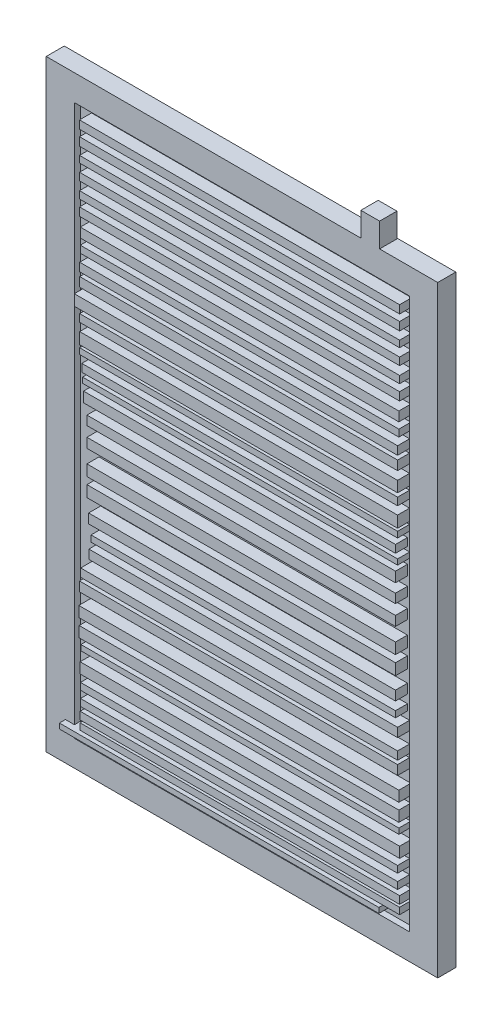
from build123d import *

# Parameters (mm, degrees)
SKETCH1_W           = 65
SKETCH1_H           = 100
BOSS_EXTRUDE1_DEPTH = 3
SKETCH2_W           = 55.410167814
SKETCH2_H           = 90.98098151
CUT_EXTRUDE1_DEPTH  = 1
SKETCH3_W           = 55.623558632
SKETCH3_H           = 91.416954534
CUT_EXTRUDE2_DEPTH  = 1
SKETCH6_W           = 3.108064818
SKETCH6_H           = 2.87479715
BOSS_EXTRUDE3_DEPTH = 4
SKETCH7_W           = 53.138202779
SKETCH7_H           = 1.34003587
SKETCH7_H_2         = 1.367002675
SKETCH7_H_3         = 1.093138183
SKETCH7_H_4         = 1.2410645
SKETCH7_H_5         = 1.197960463
SKETCH7_H_6         = 1.349260721
SKETCH7_W_2         = 52.888399092
SKETCH7_H_7         = 1.564219447
SKETCH7_H_8         = 1.154957354
SKETCH7_W_3         = 52.771419101
SKETCH7_H_9         = 1.382110168
SKETCH7_H_10        = 1.528385576
SKETCH7_W_4         = 53.663634192
SKETCH7_H_11        = 1.80040931
SKETCH7_H_12        = 1.2486786
SKETCH7_H_13        = 1.893914185
SKETCH7_H_14        = 0.973420041
SKETCH7_W_5         = 52.073122621
SKETCH7_H_15        = 1.279744006
SKETCH7_W_6         = 52.292340795
SKETCH7_H_16        = 0.896495241
SKETCH7_W_7         = 51.78751772
SKETCH7_H_17        = 1.679645233
SKETCH7_W_8         = 51.221344093
SKETCH7_H_18        = 1.510054375
SKETCH7_H_19        = 1.595977351
SKETCH7_H_20        = 1.821474854
SKETCH7_H_21        = 1.874986332
SKETCH7_W_9         = 50.944197518
SKETCH7_H_22        = 1.571177337
SKETCH7_W_10        = 50.546929275
SKETCH7_H_23        = 1.032965843
SKETCH7_W_11        = 51.245225755
SKETCH7_H_24        = 1.49164225
SKETCH7_W_12        = 52.610512912
SKETCH7_H_25        = 1.346344249
SKETCH7_W_13        = 52.805112466
SKETCH7_H_26        = 1.56611489
SKETCH7_W_14        = 53.13344098
SKETCH7_H_27        = 1.744841701
SKETCH7_W_15        = 53.070823892
SKETCH7_H_28        = 1.769376556
SKETCH7_W_16        = 52.783863166
SKETCH7_H_29        = 0.909486208
SKETCH7_W_17        = 53.033666853
SKETCH7_H_30        = 1.760540006
SKETCH7_W_18        = 52.646955084
SKETCH7_H_31        = 1.124717702
SKETCH7_H_32        = 1.14667208
SKETCH7_H_33        = 1.255688916
SKETCH7_H_34        = 1.074967726
SKETCH7_H_35        = 0.859854663
BOSS_EXTRUDE4_DEPTH = 2


with BuildPart() as part:
    # Sketch1 → Boss-Extrude1 (new body)
    with BuildSketch(Plane.XY):
        Rectangle(SKETCH1_W, SKETCH1_H)
    extrude(amount=BOSS_EXTRUDE1_DEPTH)

    # Sketch2 → Cut-Extrude1 (cut)
    with BuildSketch(Plane(origin=(0, 0, 0), x_dir=(-1, 0, 0), z_dir=(0, 0, -1))):
        Rectangle(SKETCH2_W, SKETCH2_H)
    extrude(amount=-CUT_EXTRUDE1_DEPTH, mode=Mode.SUBTRACT)

    # Sketch3 → Cut-Extrude2 (cut)
    with BuildSketch(Plane.XY.offset(3)):
        Rectangle(SKETCH3_W, SKETCH3_H)
    extrude(amount=-CUT_EXTRUDE2_DEPTH, mode=Mode.SUBTRACT)

    # Sketch6 → Boss-Extrude3 (add)
    with BuildSketch(Plane(origin=(0, 50, 0), x_dir=(1, 0, 0), z_dir=(0, 1, 0))):
        with Locations((21.296574144, -1.562601425)):
            Rectangle(SKETCH6_W, SKETCH6_H)
    extrude(amount=BOSS_EXTRUDE3_DEPTH)

    # Sketch7 → Boss-Extrude4 (add)
    with BuildSketch(Plane.XY.offset(2)):
        with Locations((0.599551955, 43.969609562)):
            Rectangle(SKETCH7_W, SKETCH7_H)
        with Locations((0.599551955, 41.538839141)):
            Rectangle(SKETCH7_W, SKETCH7_H_2)
        with Locations((0.599551955, 38.992532951)):
            Rectangle(SKETCH7_W, SKETCH7_H_3)
        with Locations((0.599551955, 36.493140866)):
            Rectangle(SKETCH7_W, SKETCH7_H_4)
        with Locations((0.599551955, 33.867810607)):
            Rectangle(SKETCH7_W, SKETCH7_H_5)
        with Locations((0.599551955, 31.458436664)):
            Rectangle(SKETCH7_W, SKETCH7_H_6)
        with Locations((0.599551954, 28.510640838)):
            Rectangle(SKETCH7_W_2, SKETCH7_H_7)
        with Locations((0.599551954, 26.112437241)):
            Rectangle(SKETCH7_W_2, SKETCH7_H_8)
        with Locations((0.446107546, 23.502504221)):
            Rectangle(SKETCH7_W_3, SKETCH7_H_9)
        with Locations((0.446107546, 21.366739211)):
            Rectangle(SKETCH7_W_3, SKETCH7_H_10)
        with Locations((0, 18.320450523)):
            Rectangle(SKETCH7_W_4, SKETCH7_H_11)
        with Locations((0.446107546, 16.176862315)):
            Rectangle(SKETCH7_W_3, SKETCH7_H_12)
        with Locations((0.446107546, 13.275450546)):
            Rectangle(SKETCH7_W_3, SKETCH7_H_13)
        with Locations((0.446107546, 11.407120898)):
            Rectangle(SKETCH7_W_3, SKETCH7_H_14)
        with Locations((0.446107545, 9.187182904)):
            Rectangle(SKETCH7_W_5, SKETCH7_H_15)
        with Locations((0.685646698, 7.470402799)):
            Rectangle(SKETCH7_W_6, SKETCH7_H_16)
        with Locations((0.588909996, 5.14333033)):
            Rectangle(SKETCH7_W_7, SKETCH7_H_17)
        with Locations((0.871996809, 2.062189427)):
            Rectangle(SKETCH7_W_8, SKETCH7_H_18)
        with Locations((0.871996809, -1.172018535)):
            Rectangle(SKETCH7_W_8, SKETCH7_H_19)
        with Locations((0.871996809, -5.111412921)):
            Rectangle(SKETCH7_W_8, SKETCH7_H_20)
        with Locations((0.871996809, -8.118690186)):
            Rectangle(SKETCH7_W_8, SKETCH7_H_21)
        with Locations((1.010570097, -11.904269807)):
            Rectangle(SKETCH7_W_9, SKETCH7_H_22)
        with Locations((1.209204219, -14.593957629)):
            Rectangle(SKETCH7_W_10, SKETCH7_H_23)
        with Locations((1.209204219, -17.029411585)):
            Rectangle(SKETCH7_W_11, SKETCH7_H_24)
        with Locations((0.52656064, -20.359590561)):
            Rectangle(SKETCH7_W_12, SKETCH7_H_25)
        with Locations((0.429260863, -22.436236668)):
            Rectangle(SKETCH7_W_13, SKETCH7_H_26)
        with Locations((0.47703101, -26.096936567)):
            Rectangle(SKETCH7_W_14, SKETCH7_H_27)
        with Locations((0.508339554, -28.969283574)):
            Rectangle(SKETCH7_W_15, SKETCH7_H_28)
        with Locations((0.651819917, -31.122255567)):
            Rectangle(SKETCH7_W_16, SKETCH7_H_29)
        with Locations((0.651819918, -34.0933672)):
            Rectangle(SKETCH7_W_17, SKETCH7_H_30)
        with Locations((0.508339554, -36.71533457)):
            Rectangle(SKETCH7_W_18, SKETCH7_H_31)
        with Locations((0.508339554, -39.040967639)):
            Rectangle(SKETCH7_W_18, SKETCH7_H_32)
        with Locations((0.651819918, -40.955030825)):
            Rectangle(SKETCH7_W_17, SKETCH7_H_33)
        with Locations((0.651819918, -42.532526617)):
            Rectangle(SKETCH7_W_17, SKETCH7_H_34)
        with Locations((-2.790527687, -44.172298267)):
            Rectangle(SKETCH7_W_17, SKETCH7_H_35)
    extrude(amount=BOSS_EXTRUDE4_DEPTH)


solid = part.part
